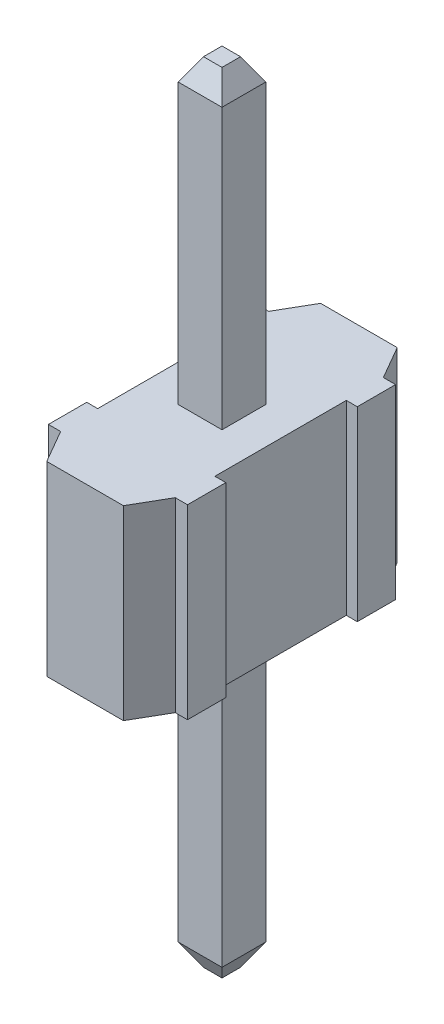
from build123d import *
from OCP.BRepFilletAPI import BRepFilletAPI_MakeChamfer

# Parameters (mm, degrees)
EXTRUDE_1_DEPTH = 0.85
SKETCH_4_W      = 0.4
SKETCH_4_H      = 0.4
EXTRUDE_2_DEPTH = 3.6
CHAMFER_1_SIZE  = 0.2
CHAMFER_1_SIZE2 = 0.115470054
CHAMFER_2_SIZE  = 0.2
CHAMFER_2_SIZE2 = 0.115470054


with BuildPart() as part:
    # 草图1 → 凸台-拉伸1 (new, symmetric)
    with BuildSketch(Plane(origin=(0, 0, 0), x_dir=(1, 0, 0), z_dir=(0, 1, 0))):
        Polygon((-0.635, -0.95), (-0.523205081, -0.95), (-0.35, -1.25), (0.35, -1.25), (0.523205081, -0.95), (0.635, -0.95), (0.635, -0.6), (0.535, -0.6), (0.535, 0.6), (0.635, 0.6), (0.635, 0.95), (0.523205081, 0.95), (0.35, 1.25), (-0.35, 1.25), (-0.523205081, 0.95), (-0.635, 0.95), (-0.635, 0.6), (-0.535, 0.6), (-0.535, -0.6), (-0.635, -0.6), align=None)
    extrude(amount=EXTRUDE_1_DEPTH, both=True)

    # 草图4 → 凸台-拉伸2 (add, symmetric)
    with BuildSketch(Plane(origin=(0, 0, 0), x_dir=(1, 0, 0), z_dir=(0, 1, 0))):
        Rectangle(SKETCH_4_W, SKETCH_4_H)
    extrude(amount=EXTRUDE_2_DEPTH, both=True)

    # 倒角1: one chamfer whose edges measure the first distance from different faces: ONE call of the kernel's chamfer builder (chamfer() names one face for all edges)
    chamfer_1_edges_1 = [part.edges().sort_by_distance(p)[0] for p in [
        (-0.2, 3.6, 0),
    ]]
    chamfer_1_side_1 = [part.faces().sort_by_distance(p)[0] for p in [
        (-0.2, 2.225, 0),
    ]]
    chamfer_1_edges_2 = [part.edges().sort_by_distance(p)[0] for p in [
        (0, 3.6, 0.2),
    ]]
    chamfer_1_side_2 = [part.faces().sort_by_distance(p)[0] for p in [
        (0, 2.225, 0.2),
    ]]
    chamfer_1_edges_3 = [part.edges().sort_by_distance(p)[0] for p in [
        (0.2, 3.6, 0),
    ]]
    chamfer_1_side_3 = [part.faces().sort_by_distance(p)[0] for p in [
        (0.2, 2.225, 0),
    ]]
    chamfer_1_edges_4 = [part.edges().sort_by_distance(p)[0] for p in [
        (0, 3.6, -0.2),
    ]]
    chamfer_1_side_4 = [part.faces().sort_by_distance(p)[0] for p in [
        (0, 2.225, -0.2),
    ]]
    chamfer_1 = BRepFilletAPI_MakeChamfer(part.part.solid().wrapped)
    for e in chamfer_1_edges_1:
        chamfer_1.Add(CHAMFER_1_SIZE, CHAMFER_1_SIZE2, e.wrapped, chamfer_1_side_1[0].wrapped)  # the first distance lies on this face
    for e in chamfer_1_edges_2:
        chamfer_1.Add(CHAMFER_1_SIZE, CHAMFER_1_SIZE2, e.wrapped, chamfer_1_side_2[0].wrapped)  # the first distance lies on this face
    for e in chamfer_1_edges_3:
        chamfer_1.Add(CHAMFER_1_SIZE, CHAMFER_1_SIZE2, e.wrapped, chamfer_1_side_3[0].wrapped)  # the first distance lies on this face
    for e in chamfer_1_edges_4:
        chamfer_1.Add(CHAMFER_1_SIZE, CHAMFER_1_SIZE2, e.wrapped, chamfer_1_side_4[0].wrapped)  # the first distance lies on this face
    add(Compound.cast(chamfer_1.Shape()), mode=Mode.REPLACE)

    # 倒角2: one chamfer whose edges measure the first distance from different faces: ONE call of the kernel's chamfer builder (chamfer() names one face for all edges)
    chamfer_2_edges_1 = [part.edges().sort_by_distance(p)[0] for p in [
        (-0.2, -3.6, 0),
    ]]
    chamfer_2_side_1 = [part.faces().sort_by_distance(p)[0] for p in [
        (-0.2, -2.225, 0),
    ]]
    chamfer_2_edges_2 = [part.edges().sort_by_distance(p)[0] for p in [
        (0, -3.6, 0.2),
    ]]
    chamfer_2_side_2 = [part.faces().sort_by_distance(p)[0] for p in [
        (0, -2.225, 0.2),
    ]]
    chamfer_2_edges_3 = [part.edges().sort_by_distance(p)[0] for p in [
        (0.2, -3.6, 0),
    ]]
    chamfer_2_side_3 = [part.faces().sort_by_distance(p)[0] for p in [
        (0.2, -2.225, 0),
    ]]
    chamfer_2_edges_4 = [part.edges().sort_by_distance(p)[0] for p in [
        (0, -3.6, -0.2),
    ]]
    chamfer_2_side_4 = [part.faces().sort_by_distance(p)[0] for p in [
        (0, -2.225, -0.2),
    ]]
    chamfer_2 = BRepFilletAPI_MakeChamfer(part.part.solid().wrapped)
    for e in chamfer_2_edges_1:
        chamfer_2.Add(CHAMFER_2_SIZE, CHAMFER_2_SIZE2, e.wrapped, chamfer_2_side_1[0].wrapped)  # the first distance lies on this face
    for e in chamfer_2_edges_2:
        chamfer_2.Add(CHAMFER_2_SIZE, CHAMFER_2_SIZE2, e.wrapped, chamfer_2_side_2[0].wrapped)  # the first distance lies on this face
    for e in chamfer_2_edges_3:
        chamfer_2.Add(CHAMFER_2_SIZE, CHAMFER_2_SIZE2, e.wrapped, chamfer_2_side_3[0].wrapped)  # the first distance lies on this face
    for e in chamfer_2_edges_4:
        chamfer_2.Add(CHAMFER_2_SIZE, CHAMFER_2_SIZE2, e.wrapped, chamfer_2_side_4[0].wrapped)  # the first distance lies on this face
    add(Compound.cast(chamfer_2.Shape()), mode=Mode.REPLACE)


solid = part.part
